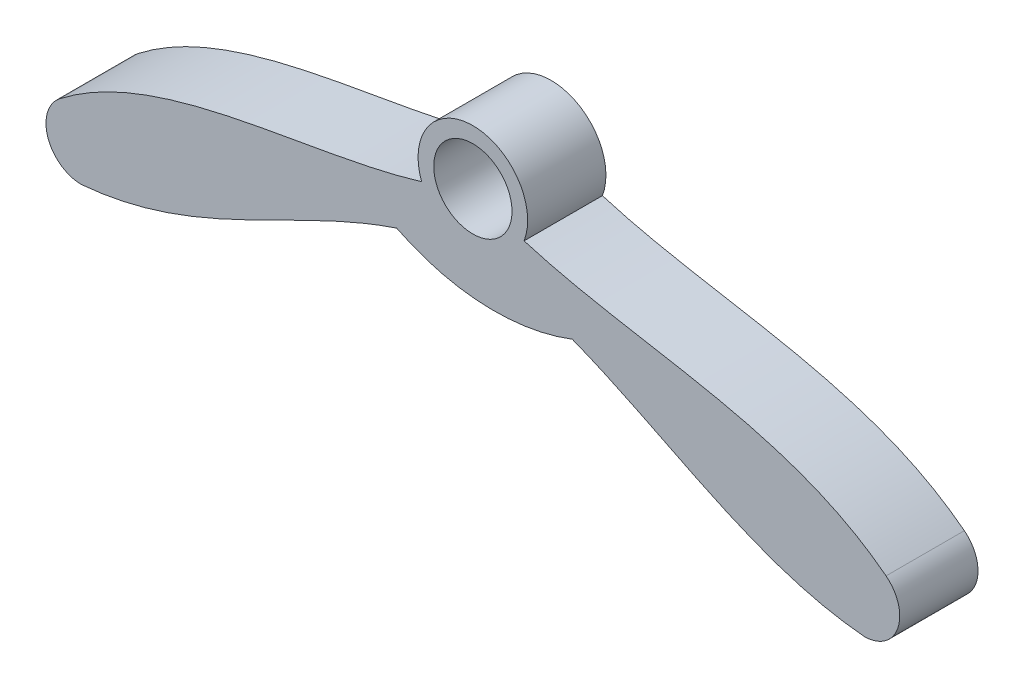
from build123d import *

# Parameters (mm, degrees)
SKETCH1_R           = 5
BOSS_EXTRUDE2_DEPTH = 10


with BuildPart() as part:
    # Sketch1 → Boss-Extrude2 (new body)
    with BuildSketch(Plane.XY):
        with BuildLine():
            ThreePointArc((6.543934444, -2.485341424), (0, 7), (-6.543934444, -2.485341424))
            add(Edge.make_bspline(
                [(-6.543934444, -2.485341424), (-21.380303677, -6.980575662), (-40.047381701, -6.507084717), (-52.782972627, -16.427166435)],
                knots=[0.13340661, 0.13340661, 0.13340661, 0.13340661, 1, 1, 1, 1], degree=3))
            ThreePointArc((-52.782972627, -16.427166435), (-54.283149744, -21.471293509), (-50, -24.528805176))
            add(Edge.make_bspline(
                [(-50, -24.528805176), (-34.847891341, -23.200206491), (-23.436440722, -13.787418989), (-9.736135771, -9.213546422)],
                knots=[0, 0, 0, 0, 0.815262705, 0.815262705, 0.815262705, 0.815262705], degree=3))
            ThreePointArc((-9.736135771, -9.213546422), (1.368546444, -12.117530865), (12.699681517, -10.28655552))
            add(Edge.make_bspline(
                [(12.699681517, -10.28655552), (25.120949587, -15.117475017), (35.953024702, -23.297109091), (50, -24.528805176)],
                knots=[1, 1, 1, 1, 1.755800749, 1.755800749, 1.755800749, 1.755800749], degree=3))
            ThreePointArc((50, -24.528805176), (54.283149744, -21.471293509), (52.782972627, -16.427166435))
            add(Edge.make_bspline(
                [(6.543934444, -2.485341424), (21.380303677, -6.980575662), (40.047381701, -6.507084717), (52.782972627, -16.427166435)],
                knots=[0.13340661, 0.13340661, 0.13340661, 0.13340661, 1, 1, 1, 1], degree=3))
        make_face()
        Circle(SKETCH1_R, mode=Mode.SUBTRACT)
    extrude(amount=BOSS_EXTRUDE2_DEPTH)


solid = part.part
